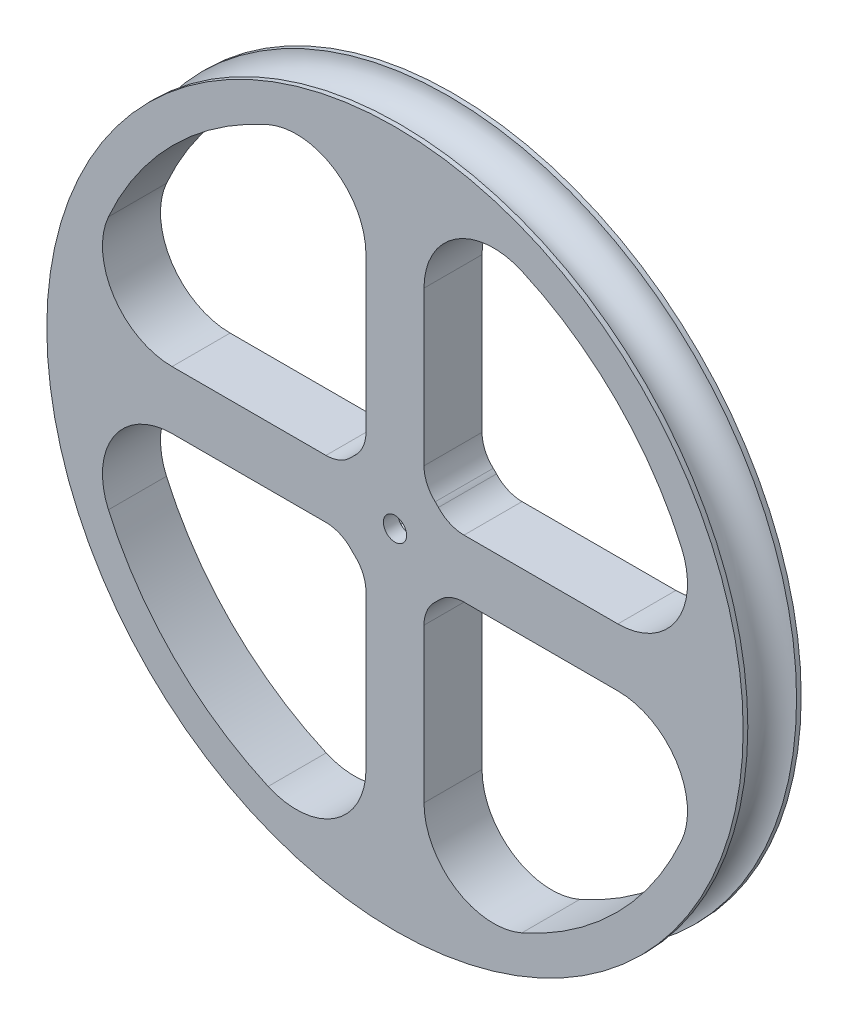
from build123d import *

# Parameters (mm, degrees)
BOSS_EXTRUDE1_START = -6.35
SKETCH3_W           = 6.35
SKETCH3_H           = 6.35
BOSS_EXTRUDE1_DEPTH = 6.35
FILLET1_R           = 7.62
FILLET2_R           = 3.81
BOSS_EXTRUDE2_START = -1.5875
SKETCH4_R           = 1.27
BOSS_EXTRUDE2_DEPTH = 1.5875


with BuildPart() as part:
    # Sketch2 → Revolve1 (revolve)
    with BuildSketch(Plane(origin=(0, 0, 0), x_dir=(1, 0, 0), z_dir=(0, 1, 0))):
        with BuildLine():
            ThreePointArc((38.1, 2.667), (35.433, 0), (38.1, -2.667))
            Line((38.1, -2.667), (38.1, -3.175))
            Line((38.1, -3.175), (34.29, -3.175))
            Line((34.29, -3.175), (34.29, 3.175))
            Line((34.29, 3.175), (38.1, 3.175))
            Line((38.1, 3.175), (38.1, 2.667))
        make_face()
    revolve(axis=Axis((0, 0, 2.667), (0, 0, -1)))

    # Sketch3 → Boss-Extrude1 (add)
    # profile 1 of 19: a face of its own
    with BuildSketch(Plane.XY.offset(3.175).offset(BOSS_EXTRUDE1_START)):
        with BuildLine():
            ThreePointArc((-34.142692849, 3.175), (-34.29, 0), (-34.142692849, -3.175))
            Line((-34.142692849, -3.175), (-5.645432136, -3.175))
            ThreePointArc((-5.645432136, -3.175), (-6.477, 0), (-5.645432136, 3.175))
            Line((-5.645432136, 3.175), (-34.142692849, 3.175))
        make_face()
    # profile 2 of 19: a face of its own
    with BuildSketch(Plane.XY.offset(3.175).offset(BOSS_EXTRUDE1_START)):
        with BuildLine():
            Line((5.645432136, -3.175), (34.142692849, -3.175))
            ThreePointArc((34.142692849, -3.175), (34.253153415, -1.589207695), (34.29, 0))
            ThreePointArc((34.29, 0), (34.253153415, 1.589207695), (34.142692849, 3.175))
            Line((34.142692849, 3.175), (5.645432136, 3.175))
            ThreePointArc((5.645432136, 3.175), (6.265660099, 1.641046169), (6.477, 0))
            ThreePointArc((6.477, 0), (6.265660099, -1.641046169), (5.645432136, -3.175))
        make_face()
    # profile 3 of 19: a face of its own
    with BuildSketch(Plane.XY.offset(3.175).offset(BOSS_EXTRUDE1_START)):
        with BuildLine():
            ThreePointArc((-5.645432136, 3.175), (-6.477, 0), (-5.645432136, -3.175))
            Line((-5.645432136, -3.175), (-3.175, -3.175))
            Line((-3.175, -3.175), (-3.175, 3.175))
            Line((-3.175, 3.175), (-5.645432136, 3.175))
        make_face()
    # profile 4 of 19: a face of its own
    with BuildSketch(Plane.XY.offset(3.175).offset(BOSS_EXTRUDE1_START)):
        with BuildLine():
            Line((-3.175, 5.645432136), (-3.175, 3.175))
            Line((-3.175, 3.175), (3.175, 3.175))
            Line((3.175, 3.175), (3.175, 5.645432136))
            ThreePointArc((3.175, 5.645432136), (0, 6.477), (-3.175, 5.645432136))
        make_face()
    # profile 5 of 19: a face of its own
    with BuildSketch(Plane.XY.offset(3.175).offset(BOSS_EXTRUDE1_START)):
        with BuildLine():
            Line((-3.175, -5.645432136), (-3.175, -34.142692849))
            ThreePointArc((-3.175, -34.142692849), (0, -34.29), (3.175, -34.142692849))
            Line((3.175, -34.142692849), (3.175, -5.645432136))
            ThreePointArc((3.175, -5.645432136), (0, -6.477), (-3.175, -5.645432136))
        make_face()
    # profile 6 of 19: a face of its own
    with BuildSketch(Plane.XY.offset(3.175).offset(BOSS_EXTRUDE1_START)):
        with BuildLine():
            ThreePointArc((3.175, 34.142692849), (0, 34.29), (-3.175, 34.142692849))
            Line((-3.175, 34.142692849), (-3.175, 5.645432136))
            ThreePointArc((-3.175, 5.645432136), (0, 6.477), (3.175, 5.645432136))
            Line((3.175, 5.645432136), (3.175, 34.142692849))
        make_face()
    # profile 7 of 19: a face of its own
    with BuildSketch(Plane.XY.offset(3.175).offset(BOSS_EXTRUDE1_START)):
        with BuildLine():
            ThreePointArc((-3.175, 5.645432136), (-4.579930622, 4.579930622), (-5.645432136, 3.175))
            Line((-5.645432136, 3.175), (-3.175, 3.175))
            Line((-3.175, 3.175), (-3.175, 5.645432136))
        make_face()
    # profile 8 of 19: a face of its own
    with BuildSketch(Plane.XY.offset(3.175).offset(BOSS_EXTRUDE1_START)):
        with BuildLine():
            Line((3.175, 5.645432136), (3.175, 3.175))
            Line((3.175, 3.175), (5.645432136, 3.175))
            ThreePointArc((5.645432136, 3.175), (4.579930622, 4.579930622), (3.175, 5.645432136))
        make_face()
    # profile 9 of 19: a face of its own
    with BuildSketch(Plane.XY.offset(3.175).offset(BOSS_EXTRUDE1_START)):
        with BuildLine():
            Line((3.175, 3.175), (3.175, -3.175))
            Line((3.175, -3.175), (5.645432136, -3.175))
            ThreePointArc((5.645432136, -3.175), (6.265660099, -1.641046169), (6.477, 0))
            ThreePointArc((6.477, 0), (6.265660099, 1.641046169), (5.645432136, 3.175))
            Line((5.645432136, 3.175), (3.175, 3.175))
        make_face()
    # profile 10 of 19: a face of its own
    with BuildSketch(Plane.XY.offset(3.175).offset(BOSS_EXTRUDE1_START)):
        with BuildLine():
            ThreePointArc((-34.142692849, 3.175), (-34.29, 0), (-34.142692849, -3.175))
            Line((-34.142692849, -3.175), (-5.645432136, -3.175))
            ThreePointArc((-5.645432136, -3.175), (-6.477, 0), (-5.645432136, 3.175))
            Line((-5.645432136, 3.175), (-34.142692849, 3.175))
        make_face()
    # profile 11 of 19: a face of its own
    with BuildSketch(Plane.XY.offset(3.175).offset(BOSS_EXTRUDE1_START)):
        with BuildLine():
            Line((5.645432136, -3.175), (34.142692849, -3.175))
            ThreePointArc((34.142692849, -3.175), (34.253153415, -1.589207695), (34.29, 0))
            ThreePointArc((34.29, 0), (34.253153415, 1.589207695), (34.142692849, 3.175))
            Line((34.142692849, 3.175), (5.645432136, 3.175))
            ThreePointArc((5.645432136, 3.175), (6.265660099, 1.641046169), (6.477, 0))
            ThreePointArc((6.477, 0), (6.265660099, -1.641046169), (5.645432136, -3.175))
        make_face()
    # profile 12 of 19: a face of its own
    with BuildSketch(Plane.XY.offset(3.175).offset(BOSS_EXTRUDE1_START)):
        with BuildLine():
            Line((-3.175, -5.645432136), (-3.175, -34.142692849))
            ThreePointArc((-3.175, -34.142692849), (0, -34.29), (3.175, -34.142692849))
            Line((3.175, -34.142692849), (3.175, -5.645432136))
            ThreePointArc((3.175, -5.645432136), (0, -6.477), (-3.175, -5.645432136))
        make_face()
    # profile 13 of 19: a face of its own
    with BuildSketch(Plane.XY.offset(3.175).offset(BOSS_EXTRUDE1_START)):
        with BuildLine():
            ThreePointArc((3.175, 34.142692849), (0, 34.29), (-3.175, 34.142692849))
            Line((-3.175, 34.142692849), (-3.175, 5.645432136))
            ThreePointArc((-3.175, 5.645432136), (0, 6.477), (3.175, 5.645432136))
            Line((3.175, 5.645432136), (3.175, 34.142692849))
        make_face()
    # profile 14 of 19: a face of its own
    with BuildSketch(Plane.XY.offset(3.175).offset(BOSS_EXTRUDE1_START)):
        with BuildLine():
            Line((3.175, -3.175), (-3.175, -3.175))
            Line((-3.175, -3.175), (-3.175, -5.645432136))
            ThreePointArc((-3.175, -5.645432136), (0, -6.477), (3.175, -5.645432136))
            Line((3.175, -5.645432136), (3.175, -3.175))
        make_face()
    # profile 15 of 19: a face of its own
    with BuildSketch(Plane.XY.offset(3.175).offset(BOSS_EXTRUDE1_START)):
        with BuildLine():
            Line((-3.175, -3.175), (-5.645432136, -3.175))
            ThreePointArc((-5.645432136, -3.175), (-4.579930622, -4.579930622), (-3.175, -5.645432136))
            Line((-3.175, -5.645432136), (-3.175, -3.175))
        make_face()
    # profile 16 of 19: a face of its own
    with BuildSketch(Plane.XY.offset(3.175).offset(BOSS_EXTRUDE1_START)):
        with BuildLine():
            Line((5.645432136, -3.175), (3.175, -3.175))
            Line((3.175, -3.175), (3.175, -5.645432136))
            ThreePointArc((3.175, -5.645432136), (4.579930622, -4.579930622), (5.645432136, -3.175))
        make_face()
    # profile 17 of 19: a face of its own
    with BuildSketch(Plane.XY.offset(3.175).offset(BOSS_EXTRUDE1_START)):
        Rectangle(SKETCH3_W, SKETCH3_H)
        with BuildLine():
            ThreePointArc((-1.929188106, 1.8415), (0, 2.667), (1.929188106, 1.8415))
            ThreePointArc((1.929188106, 1.8415), (2.475685125, 0.991903302), (2.667, 0))
            ThreePointArc((2.667, 0), (2.475685125, -0.991903302), (1.929188106, -1.8415))
            ThreePointArc((1.929188106, -1.8415), (0, -2.667), (-1.929188106, -1.8415))
            ThreePointArc((-1.929188106, -1.8415), (-2.667, 0), (-1.929188106, 1.8415))
        make_face(mode=Mode.SUBTRACT)
    # profile 18 of 19: a face of its own
    with BuildSketch(Plane.XY.offset(3.175).offset(BOSS_EXTRUDE1_START)):
        with BuildLine():
            Line((-1.929188106, 1.8415), (1.929188106, 1.8415))
            ThreePointArc((1.929188106, 1.8415), (0, 2.667), (-1.929188106, 1.8415))
        make_face()
    # profile 19 of 19: a face of its own
    with BuildSketch(Plane.XY.offset(3.175).offset(BOSS_EXTRUDE1_START)):
        with BuildLine():
            Line((1.929188106, -1.8415), (-1.929188106, -1.8415))
            ThreePointArc((-1.929188106, -1.8415), (0, -2.667), (1.929188106, -1.8415))
        make_face()
    extrude(amount=BOSS_EXTRUDE1_DEPTH)

    # Fillet1
    fillet1_edges = [part.edges().sort_by_distance(p)[0] for p in [
        (34.142692849, -3.175, 0),
        (34.142692849, 3.175, 0),
        (3.175, 34.142692849, 0),
        (-3.175, 34.142692849, 0),
        (-34.142692849, 3.175, 0),
        (-34.142692849, -3.175, 0),
        (-3.175, -34.142692849, 0),
        (3.175, -34.142692849, 0),
    ]]
    fillet(fillet1_edges, radius=FILLET1_R)

    # Fillet2
    fillet2_edges = [part.edges().sort_by_distance(p)[0] for p in [
        (5.645432136, 3.175, 0),
        (3.175, 5.645432136, 0),
        (-3.175, 5.645432136, 0),
        (-5.645432136, 3.175, 0),
        (-5.645432136, -3.175, 0),
        (-3.175, -5.645432136, 0),
        (3.175, -5.645432136, 0),
        (5.645432136, -3.175, 0),
    ]]
    fillet(fillet2_edges, radius=FILLET2_R)

    # Sketch4 → Boss-Extrude2 (add)
    with BuildSketch(Plane.XY.offset(3.175).offset(BOSS_EXTRUDE2_START)):
        with BuildLine():
            Line((1.929188106, 1.8415), (-1.929188106, 1.8415))
            ThreePointArc((-1.929188106, 1.8415), (-2.667, 0), (-1.929188106, -1.8415))
            Line((-1.929188106, -1.8415), (1.929188106, -1.8415))
            ThreePointArc((1.929188106, -1.8415), (2.667, 0), (1.929188106, 1.8415))
        make_face()
        Circle(SKETCH4_R, mode=Mode.SUBTRACT)
    extrude(amount=BOSS_EXTRUDE2_DEPTH)


solid = part.part
